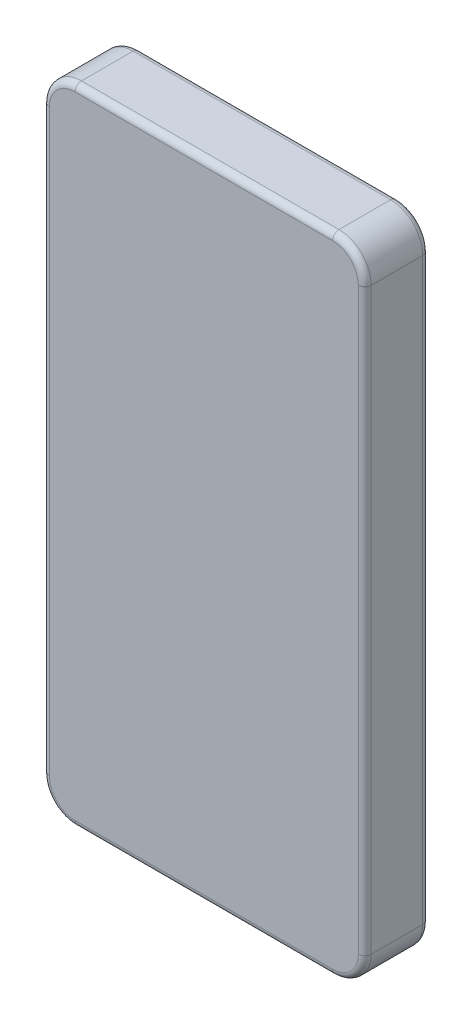
from build123d import *

# Parameters (mm, degrees)
CROQUIS1_W              = 0.5
CROQUIS1_H              = 1
SALIENTE_EXTRUIR1_DEPTH = 0.05
REDONDEO3_R             = 0.05
REDONDEO4_R             = 0.01


with BuildPart() as part:
    # Croquis1 → Saliente-Extruir1 (new, symmetric)
    with BuildSketch(Plane.XY):
        Rectangle(CROQUIS1_W, CROQUIS1_H)
    extrude(amount=SALIENTE_EXTRUIR1_DEPTH, both=True)

    # Redondeo3
    redondeo3_edges = [part.edges().sort_by_distance(p)[0] for p in [
        (-0.25, 0.5, 0),
        (0.25, 0.5, 0),
        (0.25, -0.5, 0),
        (-0.25, -0.5, 0),
    ]]
    fillet(redondeo3_edges, radius=REDONDEO3_R)

    # Redondeo4
    redondeo4_edges = [part.edges().sort_by_distance(p)[0] for p in [
        (0, -0.5, -0.05),
        (0, -0.5, 0.05),
        (-0.25, 0, -0.05),
        (0, 0.5, -0.05),
        (0.25, 0, -0.05),
        (0.235355339, 0.485355339, -0.05),
        (-0.235355339, 0.485355339, -0.05),
        (0.235355339, -0.485355339, -0.05),
        (-0.235355339, -0.485355339, -0.05),
        (-0.25, 0, 0.05),
        (0.25, 0, 0.05),
        (0, 0.5, 0.05),
        (0.235355339, 0.485355339, 0.05),
        (-0.235355339, 0.485355339, 0.05),
        (0.235355339, -0.485355339, 0.05),
        (-0.235355339, -0.485355339, 0.05),
    ]]
    fillet(redondeo4_edges, radius=REDONDEO4_R)


solid = part.part
